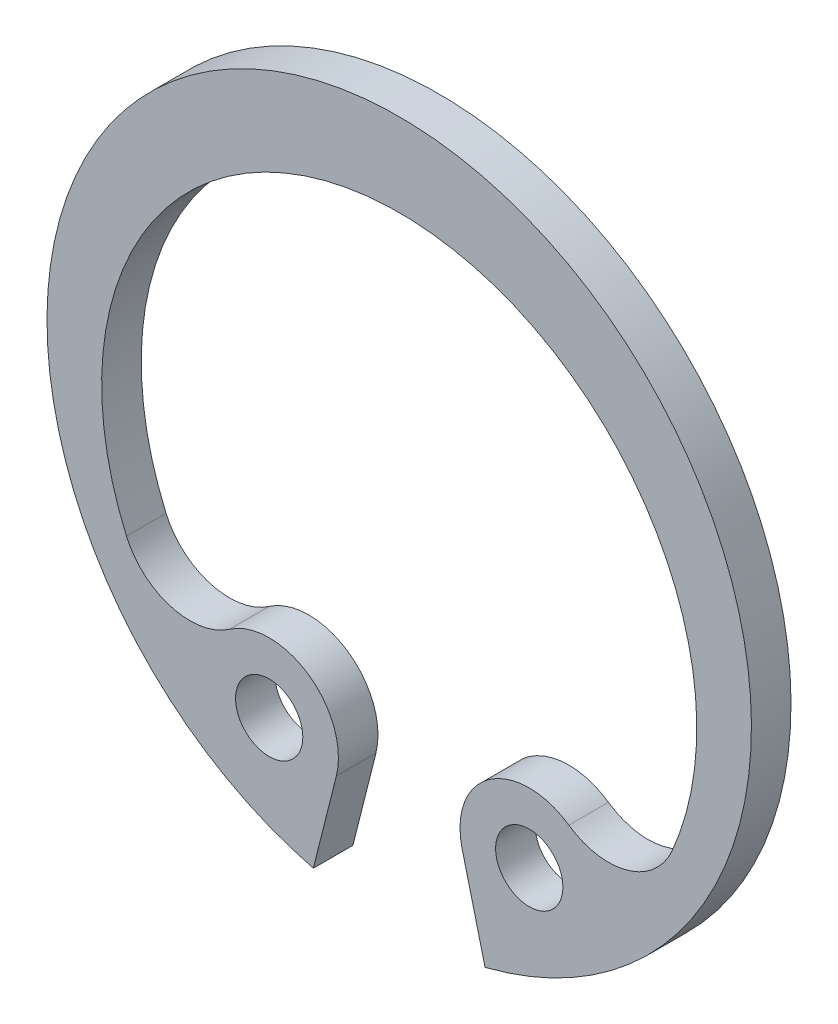
from build123d import *

# Parameters (mm, degrees)
BODYSKE_R  = 0.85
BODY_DEPTH = 1


with BuildPart() as part:
    # BodySke → Body (new body)
    with BuildSketch(Plane.XY):
        with BuildLine():
            Line((2.169189237, -8.631605763), (1.588919516, -6.322605062))
            ThreePointArc((1.588919516, -6.322605062), (2.292160062, -4.455768979), (4.287053834, -4.460571428))
            ThreePointArc((4.287053834, -4.460571428), (5.763739698, -4.70914686), (6.89205694, -3.724621042))
            ThreePointArc((6.89205694, -3.724621042), (0, 6.8), (-6.89205694, -3.724621042))
            ThreePointArc((-6.89205694, -3.724621042), (-5.763739698, -4.70914686), (-4.287053834, -4.460571428))
            ThreePointArc((-4.287053834, -4.460571428), (-2.292160062, -4.455768979), (-1.588919516, -6.322605062))
            Line((-1.588919516, -6.322605062), (-2.169189237, -8.631605763))
            ThreePointArc((-2.169189237, -8.631605763), (0, 8.9), (2.169189237, -8.631605763))
        make_face()
        with Locations((3.286145369, -5.896079088)):
            Circle(BODYSKE_R, mode=Mode.SUBTRACT)
        with Locations((-3.286145369, -5.896079088)):
            Circle(BODYSKE_R, mode=Mode.SUBTRACT)
    extrude(amount=-BODY_DEPTH)


solid = part.part
